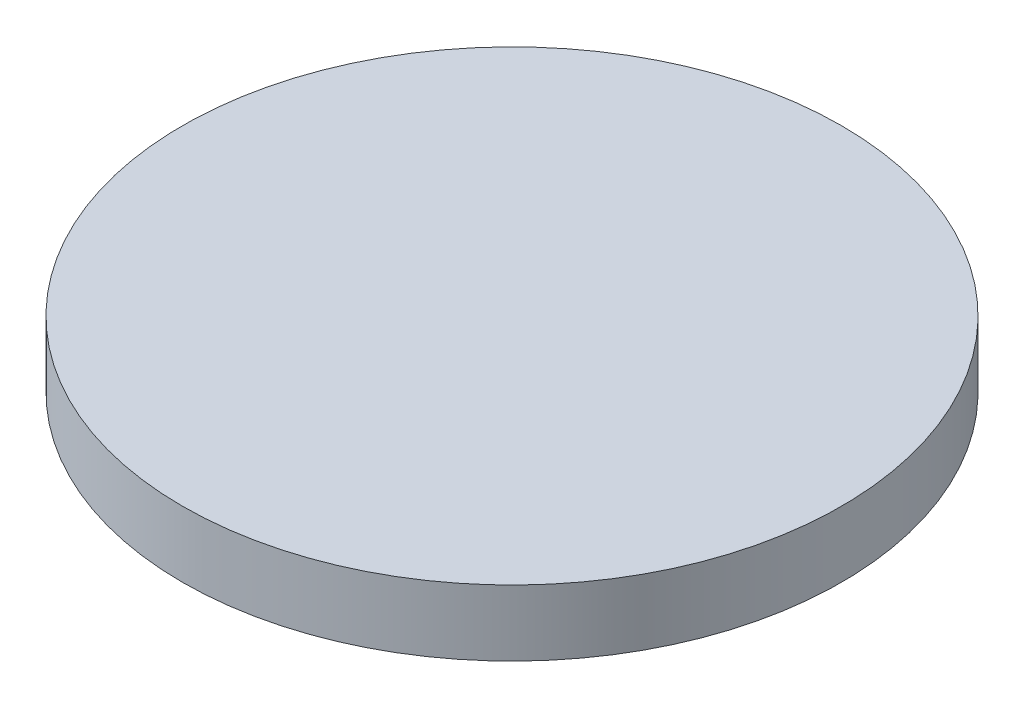
from build123d import *

# Parameters (mm, degrees)
SKETCH1_R           = 50
BOSS_EXTRUDE1_DEPTH = 10


with BuildPart() as part:
    # Sketch1 → Boss-Extrude1 (new body)
    with BuildSketch(Plane(origin=(0, 0, 0), x_dir=(1, 0, 0), z_dir=(0, 1, 0))):
        with Locations(Location((0, 0, 0), (0, 0, 270))):
            Circle(SKETCH1_R)
    extrude(amount=BOSS_EXTRUDE1_DEPTH)


solid = part.part
